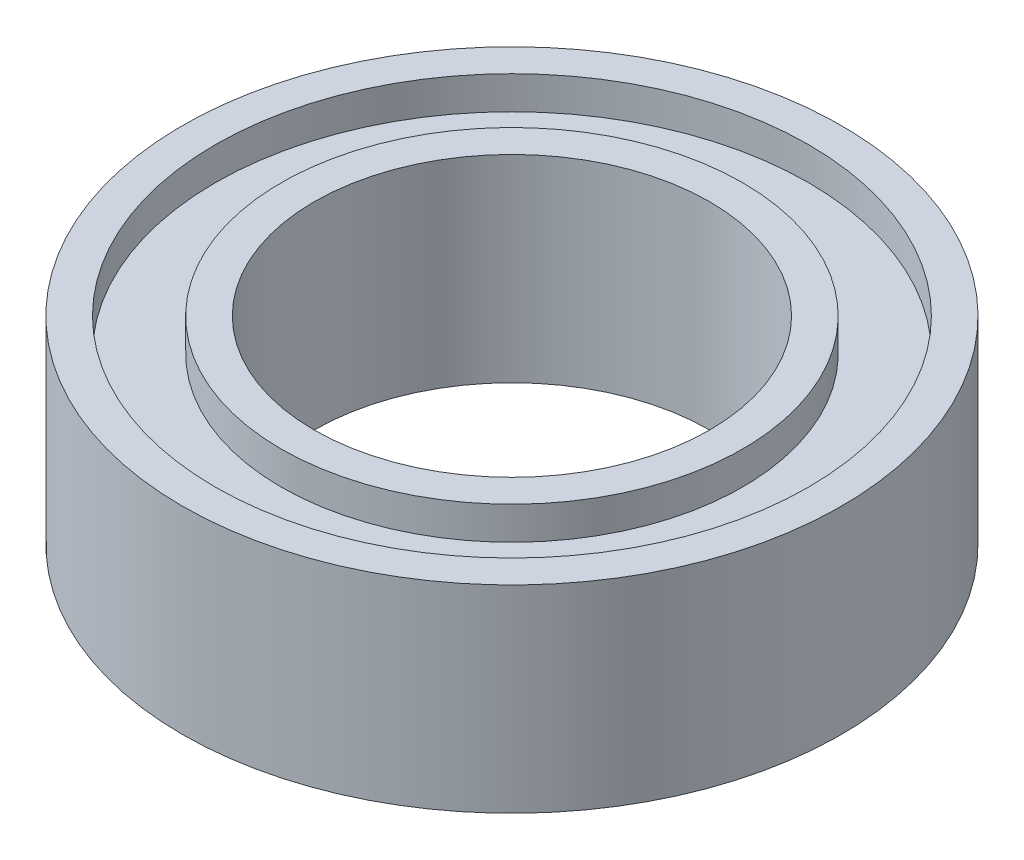
from build123d import *

# Parameters (mm, degrees)
SKETCH1_R           = 5
SKETCH1_R_2         = 3
BOSS_EXTRUDE1_DEPTH = 1.5
SKETCH5_R           = 4.5
SKETCH5_R_2         = 3.5
CUT_EXTRUDE1_DEPTH  = 0.5


with BuildPart() as part:
    # Sketch1 → Boss-Extrude1 (new, symmetric)
    with BuildSketch(Plane(origin=(0, 0, 0), x_dir=(1, 0, 0), z_dir=(0, 1, 0))):
        with Locations(Location((0, 0, 0), (0, 0, 270))):
            Circle(SKETCH1_R)
        with Locations(Location((0, 0, 0), (0, 0, 270))):
            Circle(SKETCH1_R_2, mode=Mode.SUBTRACT)
    extrude(amount=BOSS_EXTRUDE1_DEPTH, both=True)

    # Sketch5 → Cut-Extrude1 (cut)
    with BuildSketch(Plane(origin=(0, 1.5, 0), x_dir=(1, 0, 0), z_dir=(0, 1, 0))):
        with Locations(Location((0, 0, 0), (0, 0, 270))):
            Circle(SKETCH5_R)
        with Locations(Location((0, 0, 0), (0, 0, 270))):
            Circle(SKETCH5_R_2, mode=Mode.SUBTRACT)
    cut_extrude1 = extrude(amount=-CUT_EXTRUDE1_DEPTH, mode=Mode.SUBTRACT)

    # Mirror1: Cut-Extrude1 across plane
    add(cut_extrude1.mirror(Plane.ZX), mode=Mode.SUBTRACT)


solid = part.part
